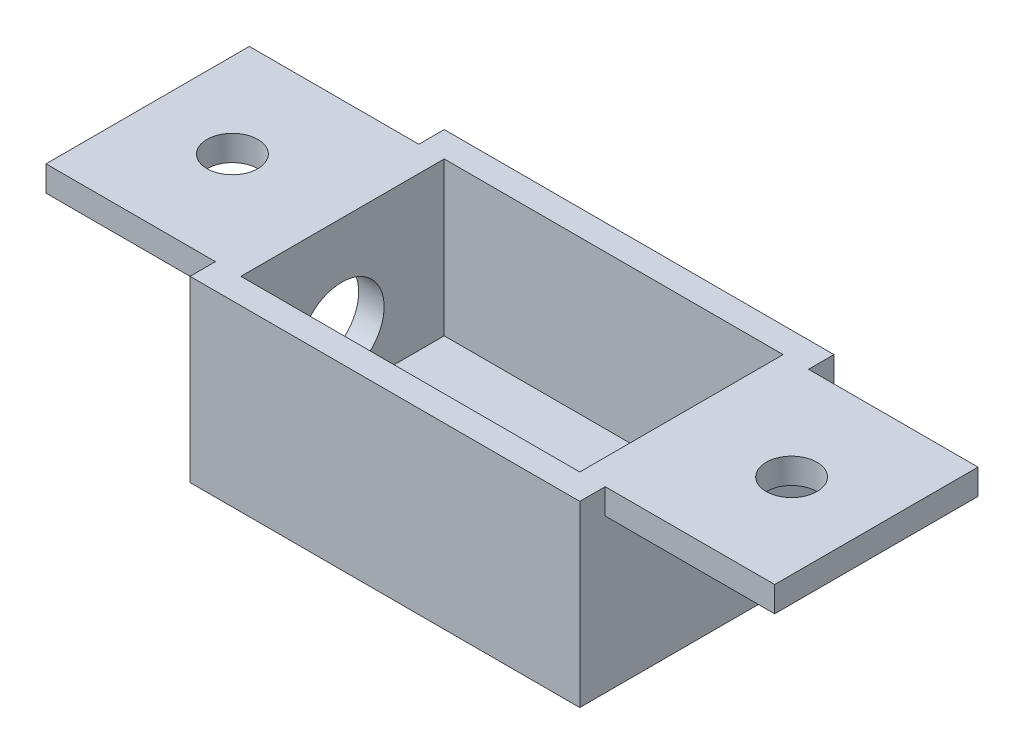
from build123d import *

# Parameters (mm, degrees)
EXTRUDE_1_DEPTH     = 24
SKETCH_2_W          = 46
SKETCH_2_H          = 21.081573772
EXTRUDE_2_DEPTH     = 3
SKETCH_3_W          = 46
SKETCH_3_H          = 21.081573772
EXTRUDE_3_DEPTH     = 3
SKETCH_6_R          = 5
CUT_EXTRUDE_2_DEPTH = 10
SKETCH_7_R          = 3
CUT_EXTRUDE_3_DEPTH = 10


with BuildPart() as part:
    # 草图1 → 凸台-拉伸1 (new body)
    with BuildSketch(Plane.XY):
        Polygon((-66, 28.893533875), (-43, 28.893533875), (-43, 10.811960103), (-3, 10.811960103), (-3, 28.893533875), (20, 28.893533875), (20, 25.893533875), (0, 25.893533875), (0, 7.811960103), (-46, 7.811960103), (-46, 25.893533875), (-66, 25.893533875), align=None)
    extrude(amount=EXTRUDE_1_DEPTH)

    # 草图2 → 凸台-拉伸2 (add)
    with BuildSketch(Plane.XY.offset(24)):
        with Locations((-23, 18.352746989)):
            Rectangle(SKETCH_2_W, SKETCH_2_H)
    extrude(amount=EXTRUDE_2_DEPTH)

    # 草图3 → 凸台-拉伸3 (add)
    with BuildSketch(Plane(origin=(0, 0, 0), x_dir=(-1, 0, 0), z_dir=(0, 0, -1))):
        with Locations((23, 18.352746989)):
            Rectangle(SKETCH_3_W, SKETCH_3_H)
    extrude(amount=EXTRUDE_3_DEPTH)

    # 草图6 → 切除-拉伸2 (cut)
    with BuildSketch(Plane.ZY.offset(46)):
        with Locations((12.093557596, 17.339206361)):
            Circle(SKETCH_6_R)
    extrude(amount=-CUT_EXTRUDE_2_DEPTH, mode=Mode.SUBTRACT)

    # 草图7 → 切除-拉伸3 (cut)
    with BuildSketch(Plane.XZ.offset(-25.893533875)):
        with Locations((10, 12)):
            Circle(SKETCH_7_R)
        with Locations((-56, 12)):
            Circle(SKETCH_7_R)
    extrude(amount=-CUT_EXTRUDE_3_DEPTH, mode=Mode.SUBTRACT)


solid = part.part
